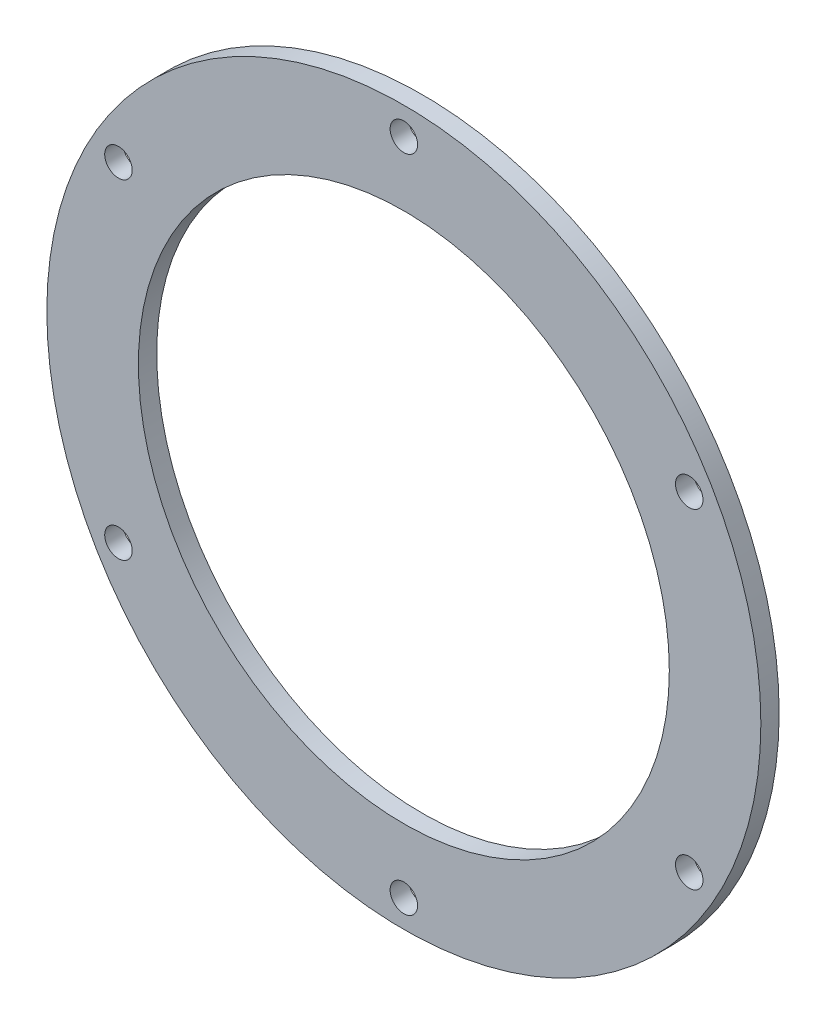
from build123d import *

# Parameters (mm, degrees)
SKETCH1_R           = 39
SKETCH1_R_2         = 1.5
SKETCH1_R_3         = 29
BOSS_EXTRUDE2_DEPTH = 2


with BuildPart() as part:
    # Sketch1 → Boss-Extrude2 (new body)
    with BuildSketch(Plane.XY):
        Circle(SKETCH1_R)
        with Locations((-31.176914536, 18)):
            Circle(SKETCH1_R_2, mode=Mode.SUBTRACT)
        with Locations((-31.176914536, -18)):
            Circle(SKETCH1_R_2, mode=Mode.SUBTRACT)
        with Locations((0, -36)):
            Circle(SKETCH1_R_2, mode=Mode.SUBTRACT)
        with Locations((31.176914536, -18)):
            Circle(SKETCH1_R_2, mode=Mode.SUBTRACT)
        with Locations((31.176914536, 18)):
            Circle(SKETCH1_R_2, mode=Mode.SUBTRACT)
        with Locations((0, 36)):
            Circle(SKETCH1_R_2, mode=Mode.SUBTRACT)
        Circle(SKETCH1_R_3, mode=Mode.SUBTRACT)
    extrude(amount=BOSS_EXTRUDE2_DEPTH)


solid = part.part
